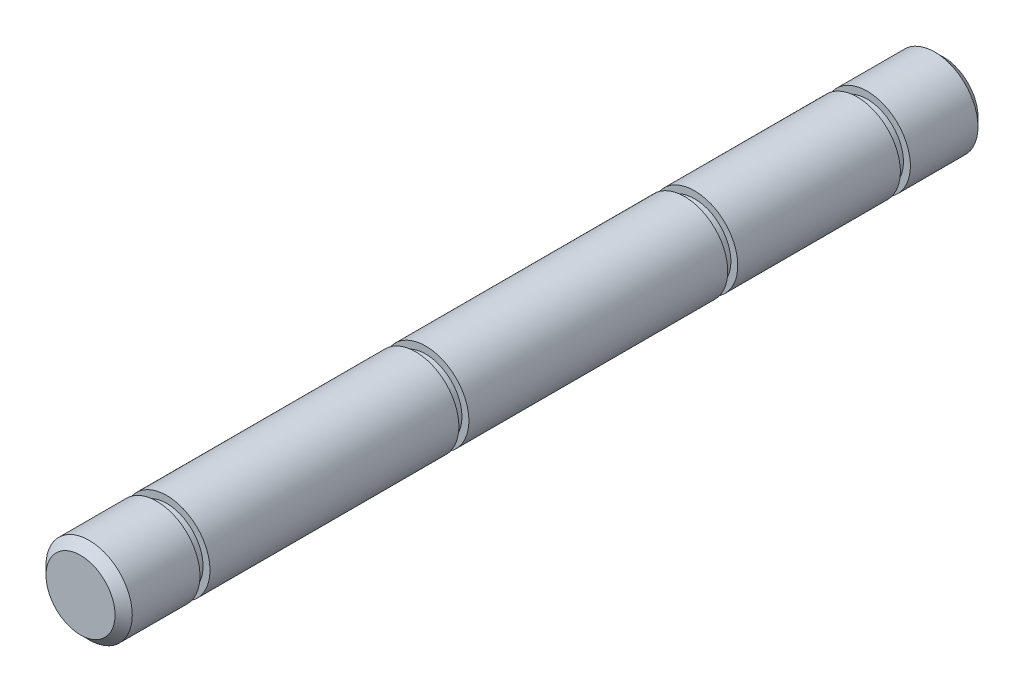
from build123d import *

# Parameters (mm, degrees)
SKETCH1_R           = 3.175
BOSS_EXTRUDE1_DEPTH = 63.5
CHAMFER1_SIZE       = 0.635
CUT_EXTRUDE1_START  = 0.7366
SKETCH2_R           = 3.175
SKETCH2_R_2         = 2.667
CUT_EXTRUDE1_DEPTH  = 0.7366
CUT_EXTRUDE3_START  = 0.7366
SKETCH4_R           = 3.175
SKETCH4_R_2         = 2.667
CUT_EXTRUDE3_DEPTH  = 0.7366
SKETCH5_R           = 3.175
SKETCH5_R_2         = 2.667
CUT_EXTRUDE4_DEPTH  = 0.7366


with BuildPart() as part:
    # Sketch1 → Boss-Extrude1 (new body)
    with BuildSketch(Plane.XY):
        Circle(SKETCH1_R)
    extrude(amount=BOSS_EXTRUDE1_DEPTH)

    # Chamfer1
    chamfer1_edges = [part.edges().sort_by_distance(p)[0] for p in [
        (-3.175, 0, 0),
        (-3.175, 0, 63.5),
    ]]
    chamfer(chamfer1_edges, length=CHAMFER1_SIZE)

    # Sketch2 → Cut-Extrude1 (cut)
    with BuildSketch(Plane(origin=(0, 0, 19.05), x_dir=(-1, 0, 0), z_dir=(0, 0, -1)).offset(CUT_EXTRUDE1_START)):
        Circle(SKETCH2_R)
        Circle(SKETCH2_R_2, mode=Mode.SUBTRACT)
    extrude(amount=-CUT_EXTRUDE1_DEPTH, mode=Mode.SUBTRACT)

    # Sketch4 → Cut-Extrude3 (cut)
    with BuildSketch(Plane(origin=(0, 0, 6.35), x_dir=(-1, 0, 0), z_dir=(0, 0, -1)).offset(CUT_EXTRUDE3_START)):
        Circle(SKETCH4_R)
        Circle(SKETCH4_R_2, mode=Mode.SUBTRACT)
    cut_extrude3 = extrude(amount=-CUT_EXTRUDE3_DEPTH, mode=Mode.SUBTRACT)

    # Mirror6: Cut-Extrude3 across plane
    add(cut_extrude3.mirror(Plane(origin=(0, 0, 31.75), x_dir=(1, 0, 0), z_dir=(0, 0, -1))), mode=Mode.SUBTRACT)

    # Sketch5 → Cut-Extrude4 (cut)
    with BuildSketch(Plane(origin=(0, 0, 38.1), x_dir=(-1, 0, 0), z_dir=(0, 0, -1))):
        Circle(SKETCH5_R)
        Circle(SKETCH5_R_2, mode=Mode.SUBTRACT)
    extrude(amount=-CUT_EXTRUDE4_DEPTH, mode=Mode.SUBTRACT)


solid = part.part
